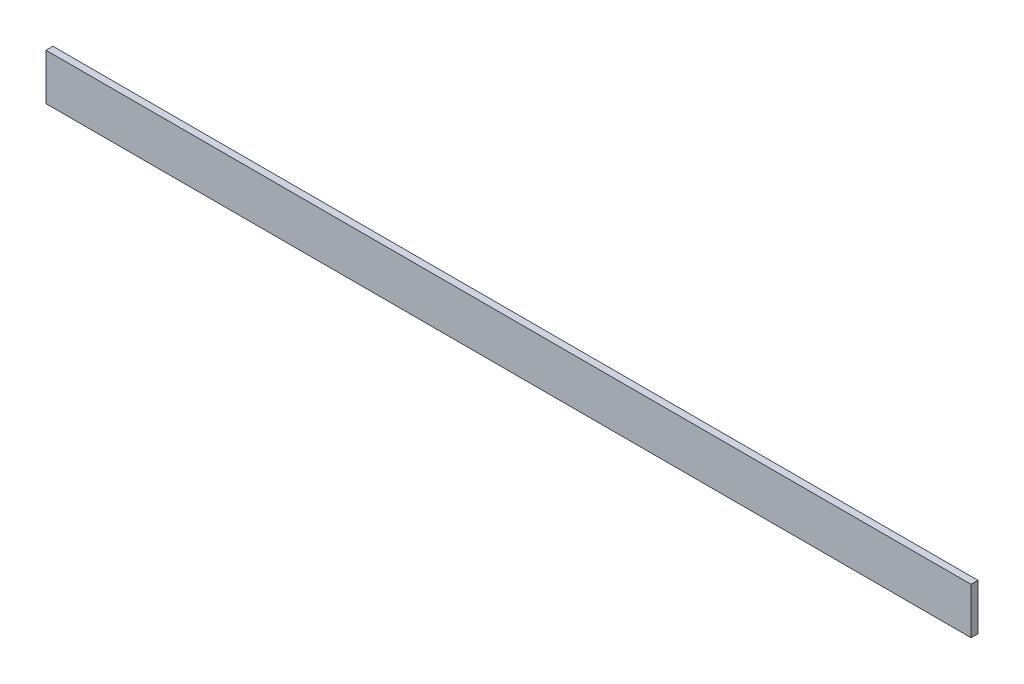
from build123d import *

# Parameters (mm, degrees)
SKETCH1_W           = 400
SKETCH1_H           = 20
BOSS_EXTRUDE1_DEPTH = 3


with BuildPart() as part:
    # Sketch1 → Boss-Extrude1 (new body)
    with BuildSketch(Plane.XY):
        with Locations((200, 10)):
            Rectangle(SKETCH1_W, SKETCH1_H)
    extrude(amount=BOSS_EXTRUDE1_DEPTH)


solid = part.part
